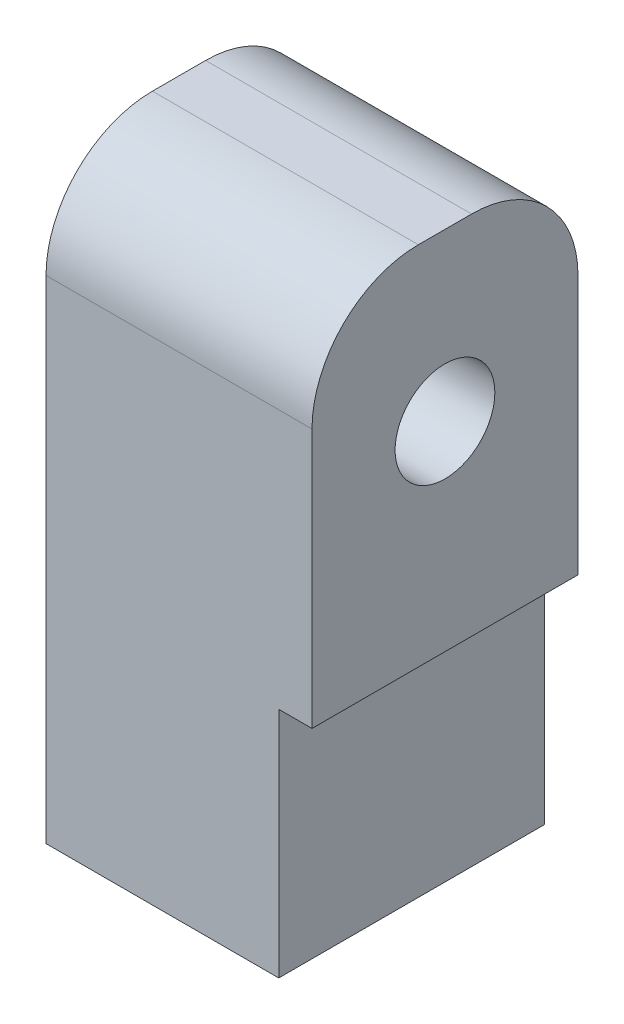
from build123d import *

# Parameters (mm, degrees)
SKETCH1_W           = 0.875
SKETCH1_H           = 1
BOSS_EXTRUDE1_DEPTH = 0.875
SKETCH2_W           = 1
SKETCH2_H           = 1
BOSS_EXTRUDE2_DEPTH = 1.375
SKETCH3_R           = 0.1875
CUT_EXTRUDE1_DEPTH  = 1
SKETCH4_R           = 0.2375
CUT_EXTRUDE2_DEPTH  = 0.125
SKETCH5_R           = 0.25
CUT_EXTRUDE3_DEPTH  = 1.188
FILLET1_R           = 0.4


with BuildPart() as part:
    # Sketch1 → Boss-Extrude1 (new body)
    with BuildSketch(Plane(origin=(0, 0, 0), x_dir=(1, 0, 0), z_dir=(0, 1, 0))):
        Rectangle(SKETCH1_W, SKETCH1_H)
    extrude(amount=BOSS_EXTRUDE1_DEPTH)

    # Sketch2 → Boss-Extrude2 (add)
    with BuildSketch(Plane(origin=(0, 0.875, 0), x_dir=(1, 0, 0), z_dir=(0, 1, 0))):
        with Locations((0.0625, 0)):
            Rectangle(SKETCH2_W, SKETCH2_H)
    extrude(amount=BOSS_EXTRUDE2_DEPTH)

    # Sketch3 → Cut-Extrude1 (cut)
    with BuildSketch(Plane(origin=(0.5625, 0, 0), x_dir=(0, 0, -1), z_dir=(1, 0, 0))):
        with Locations((0, 1.625)):
            Circle(SKETCH3_R)
    extrude(amount=-CUT_EXTRUDE1_DEPTH, mode=Mode.SUBTRACT)

    # Sketch4 → Cut-Extrude2 (cut)
    with BuildSketch(Plane.ZY.offset(0.4375)):
        with Locations((0, 1.625)):
            Circle(SKETCH4_R)
    extrude(amount=-CUT_EXTRUDE2_DEPTH, mode=Mode.SUBTRACT)

    # Sketch5 → Cut-Extrude3 (cut)
    with BuildSketch(Plane.XZ):
        with Locations(Location((0.0625, 0, 0), (0, 0, 270))):
            Circle(SKETCH5_R)
    extrude(amount=-CUT_EXTRUDE3_DEPTH, mode=Mode.SUBTRACT)

    # Fillet1
    fillet1_edges = [part.edges().sort_by_distance(p)[0] for p in [
        (0.0625, 2.25, 0.5),
        (0.0625, 2.25, -0.5),
    ]]
    fillet(fillet1_edges, radius=FILLET1_R)


solid = part.part
